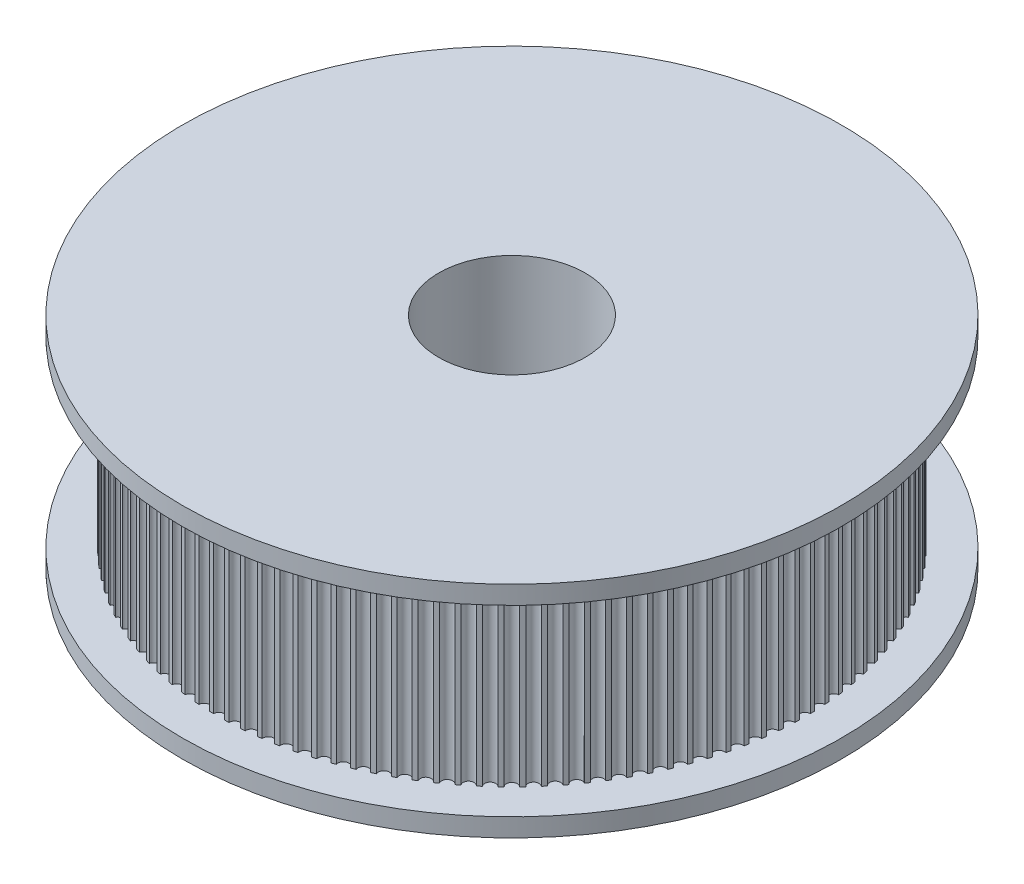
from build123d import *

# Parameters (mm, degrees)
SKETCH3_R          = 4
CUT_EXTRUDE1_DEPTH = 29
SKETCH4_R          = 0.3
CUT_EXTRUDE2_DEPTH = 10
CIRPATTERN1_COUNT  = 120


with BuildPart() as part:
    # Sketch2 → Revolve1 (revolve)
    with BuildSketch(Plane.XY, mode=Mode.PRIVATE) as revolve1_sk:
        Polygon((0, 0.912743726), (18, 0.912743726), (18, -0.087256274), (16, -0.087256274), (16, -10.087256274), (18, -10.087256274), (18, -11.087256274), (0, -11.087256274), align=None)
    revolve(revolve1_sk.sketch.rotate(Axis((0, 54.424507427, 0), (0, -1, 0)), 90), axis=Axis((0, 54.424507427, 0), (0, -1, 0)))

    # Sketch3 → Cut-Extrude1 (cut)
    with BuildSketch(Plane(origin=(0, -11.087256274, 0), x_dir=(-1, 0, 0), z_dir=(0, -1, 0))):
        with Locations(Location((0, 0, 0), (0, 0, 90))):
            Circle(SKETCH3_R)
    extrude(amount=-CUT_EXTRUDE1_DEPTH, mode=Mode.SUBTRACT)

    # Sketch4 → Cut-Extrude2 (cut)
    with BuildSketch(Plane(origin=(0, -10.087256274, 0), x_dir=(1, 0, 0), z_dir=(0, 1, 0))):
        with Locations((0, 16)):
            Circle(SKETCH4_R)
    cut_extrude2 = extrude(amount=CUT_EXTRUDE2_DEPTH, mode=Mode.SUBTRACT)

    # CirPattern1: Cut-Extrude2 ×120 about axis
    cirpattern1_axis = Axis((0, 0, 0), (0, 1, 0))
    for i in range(1, CIRPATTERN1_COUNT):
        add(cut_extrude2.rotate(cirpattern1_axis, i * 360 / CIRPATTERN1_COUNT), mode=Mode.SUBTRACT)


solid = part.part
